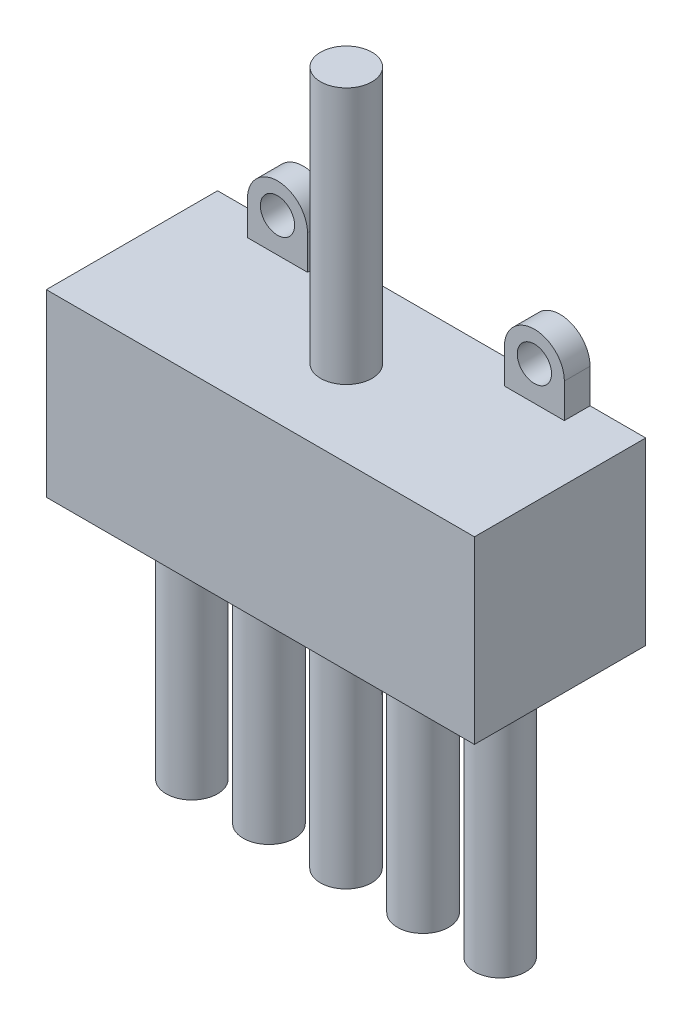
from build123d import *

# Parameters (mm, degrees)
SKETCH_1_W        = 50
SKETCH_1_H        = 21
EXTRUDE_1_DEPTH   = 20
SKETCH_2_R        = 3
EXTRUDE_2_DEPTH   = 30
EXTRUDE_2_2_DEPTH = 30
EXTRUDE_2_3_DEPTH = 30
EXTRUDE_2_4_DEPTH = 30
EXTRUDE_2_5_DEPTH = 30
SKETCH_3_R        = 3
EXTRUDE_3_DEPTH   = 30
SKETCH_4_R        = 2
EXTRUDE_4_DEPTH   = 3
EXTRUDE_4_2_DEPTH = 3


with BuildPart() as part:
    # 草图1 → 凸台-拉伸1 (new body)
    with BuildSketch(Plane.XY):
        Rectangle(SKETCH_1_W, SKETCH_1_H)
    extrude(amount=EXTRUDE_1_DEPTH)


with BuildPart() as body_2:
    # 草图2 → 凸台-拉伸2 (new body)
    with BuildSketch(Plane.XZ.offset(10.5)):
        with Locations(Location((0, 10, 0), (0, 0, 270))):
            Circle(SKETCH_2_R)
    extrude(amount=EXTRUDE_2_DEPTH)


with BuildPart() as body_3:
    # 草图2 → Extrude 2 2 (new body)
    with BuildSketch(Plane.XZ.offset(10.5)):
        with Locations(Location((9, 10, 0), (0, 0, 270))):
            Circle(SKETCH_2_R)
    extrude(amount=EXTRUDE_2_2_DEPTH)


with BuildPart() as body_4:
    # 草图2 → Extrude 2 3 (new body)
    with BuildSketch(Plane.XZ.offset(10.5)):
        with Locations(Location((18, 10, 0), (0, 0, 270))):
            Circle(SKETCH_2_R)
    extrude(amount=EXTRUDE_2_3_DEPTH)


with BuildPart() as body_5:
    # 草图2 → Extrude 2 4 (new body)
    with BuildSketch(Plane.XZ.offset(10.5)):
        with Locations(Location((-18, 10, 0), (0, 0, 90))):
            Circle(SKETCH_2_R)
    extrude(amount=EXTRUDE_2_4_DEPTH)


with BuildPart() as body_6:
    # 草图2 → Extrude 2 5 (new body)
    with BuildSketch(Plane.XZ.offset(10.5)):
        with Locations(Location((-9, 10, 0), (0, 0, 90))):
            Circle(SKETCH_2_R)
    extrude(amount=EXTRUDE_2_5_DEPTH)


with BuildPart() as body_7:
    # 草图3 → 凸台-拉伸3 (new body)
    with BuildSketch(Plane(origin=(0, 10.5, 0), x_dir=(1, 0, 0), z_dir=(0, 1, 0))):
        with Locations(Location((0, -9.963882653, 0), (0, 0, 270))):
            Circle(SKETCH_3_R)
    extrude(amount=EXTRUDE_3_DEPTH)


with BuildPart() as body_8:
    # 草图4 → 凸台-拉伸4 (new body)
    with BuildSketch(Plane(origin=(0, 0, 0), x_dir=(-1, 0, 0), z_dir=(0, 0, -1))):
        with BuildLine():
            Line((-18.5, 14.5), (-18.5, 10.5))
            Line((-18.5, 10.5), (-11.5, 10.5))
            Line((-11.5, 10.5), (-11.5, 14.5))
            ThreePointArc((-11.5, 14.5), (-15, 18), (-18.5, 14.5))
        make_face()
        with Locations((-15, 14.5)):
            Circle(SKETCH_4_R, mode=Mode.SUBTRACT)
    extrude(amount=-EXTRUDE_4_DEPTH)


with BuildPart() as body_9:
    # 草图4 → Extrude 4 2 (new body)
    with BuildSketch(Plane(origin=(0, 0, 0), x_dir=(-1, 0, 0), z_dir=(0, 0, -1))):
        with BuildLine():
            Line((18.5, 10.5), (11.5, 10.5))
            Line((11.5, 10.5), (11.5, 14.5))
            ThreePointArc((11.5, 14.5), (15, 18), (18.5, 14.5))
            Line((18.5, 14.5), (18.5, 10.5))
        make_face()
        with Locations(Location((15, 14.5, 0), (0, 0, 180))):
            Circle(SKETCH_4_R, mode=Mode.SUBTRACT)
    extrude(amount=-EXTRUDE_4_2_DEPTH)


solid = Compound([part.part, body_2.part, body_3.part, body_4.part, body_5.part, body_6.part, body_7.part, body_8.part, body_9.part])
